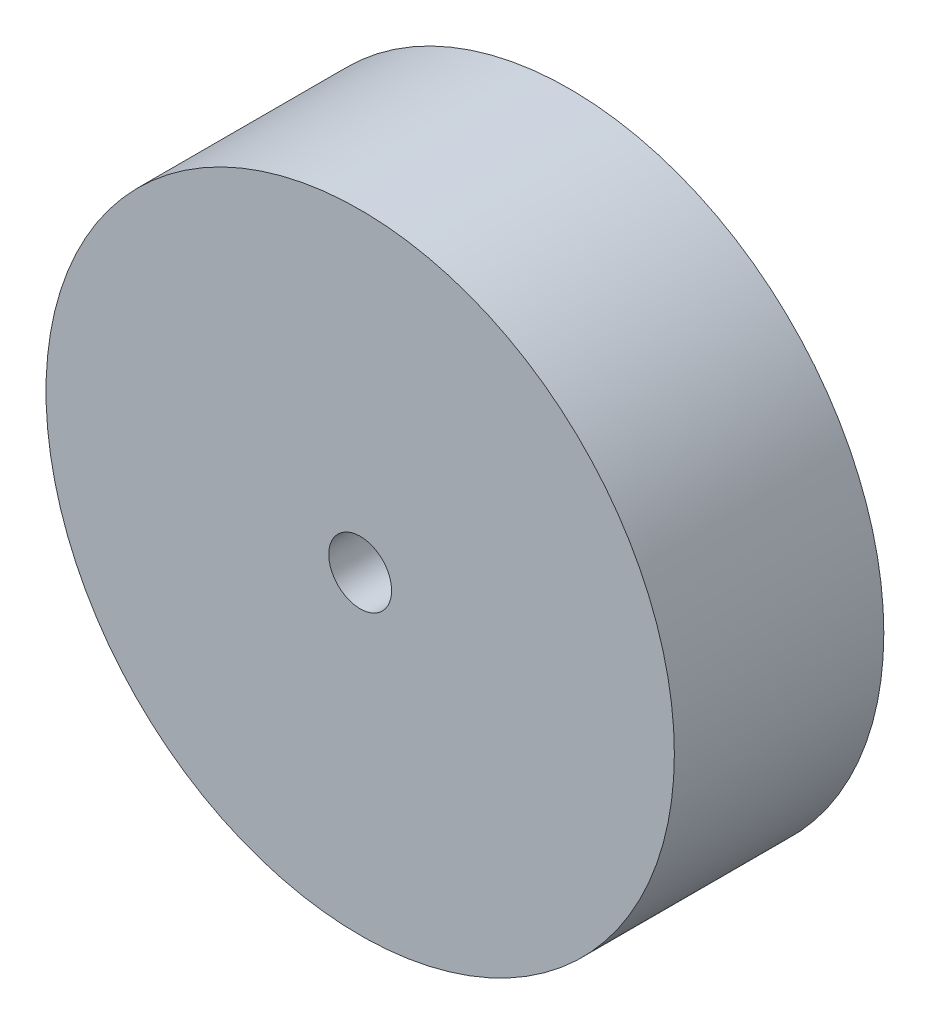
from build123d import *

# Parameters (mm, degrees)
SKETCH_1_R      = 15
SKETCH_1_R_2    = 1.5
EXTRUDE_2_DEPTH = 10


with BuildPart() as part:
    # 草图1 → 凸台-拉伸2 (new body)
    with BuildSketch(Plane.XY):
        Circle(SKETCH_1_R)
        Circle(SKETCH_1_R_2, mode=Mode.SUBTRACT)
    extrude(amount=EXTRUDE_2_DEPTH)


solid = part.part
